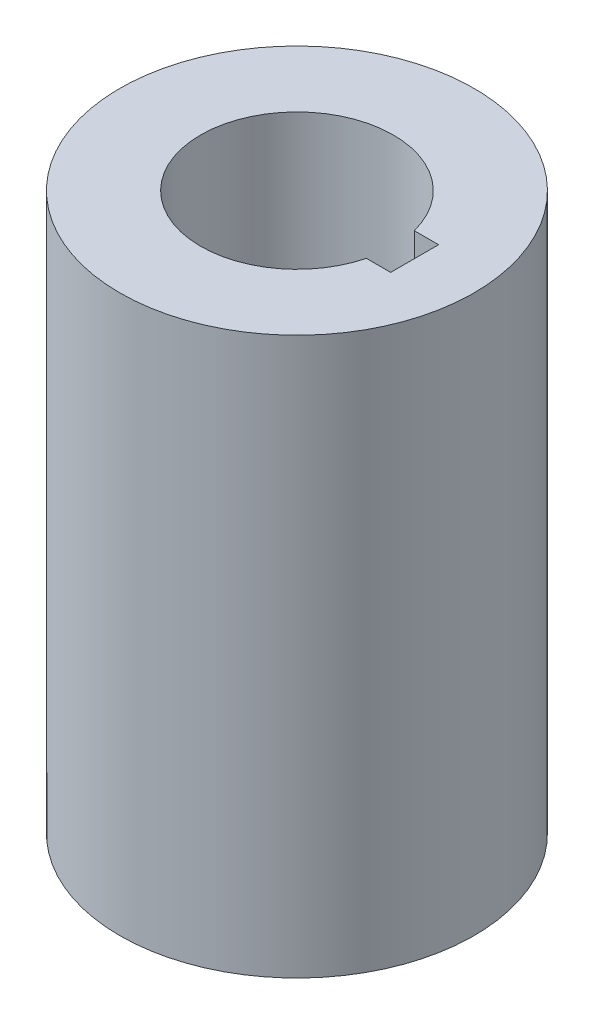
from build123d import *

# Parameters (mm, degrees)
SKETCH1_R           = 17.5
BOSS_EXTRUDE1_DEPTH = 55
SKETCH2_R           = 9.525
CUT_EXTRUDE1_DEPTH  = 23
CUT_EXTRUDE2_REACH  = 42.454
SKETCH5_R           = 6
CUT_EXTRUDE3_DEPTH  = 23


with BuildPart() as part:
    # Sketch1 → Boss-Extrude1 (new body)
    with BuildSketch(Plane(origin=(0, 0, 0), x_dir=(1, 0, 0), z_dir=(0, 1, 0))):
        with Locations(Location((0, 0, 0), (0, 0, 270))):
            Circle(SKETCH1_R)
    extrude(amount=BOSS_EXTRUDE1_DEPTH)

    # Sketch2 → Cut-Extrude1 (cut)
    with BuildSketch(Plane(origin=(0, 55, 0), x_dir=(1, 0, 0), z_dir=(0, 1, 0))):
        with Locations(Location((0, 0, 0), (0, 0, 270))):
            Circle(SKETCH2_R)
    extrude(amount=-CUT_EXTRUDE1_DEPTH, mode=Mode.SUBTRACT)

    # Sketch3 → Cut-Extrude2 (cut, up to next)
    with BuildSketch(Plane(origin=(0, 32, 0), x_dir=(1, 0, 0), z_dir=(0, 1, 0)), mode=Mode.PRIVATE) as cut_extrude2_sk1:
        Polygon((9.525, 2.37), (11.625, 2.37), (11.625, -2.366924295), (6.895, -2.366924295), (6.895, 2.37), align=None)
    cut_extrude2_tool1 = extrude(cut_extrude2_sk1.sketch, amount=CUT_EXTRUDE2_REACH, mode=Mode.PRIVATE) & part.part
    add(cut_extrude2_tool1.solids().sort_by_distance((9.26, 32, -0.001538))[0], mode=Mode.SUBTRACT)

    # Sketch5 → Cut-Extrude3 (cut)
    with BuildSketch(Plane(origin=(0, 0, 0), x_dir=(-1, 0, 0), z_dir=(0, -1, 0))):
        with Locations(Location((0, 0, 0), (0, 0, 90))):
            Circle(SKETCH5_R)
    extrude(amount=-CUT_EXTRUDE3_DEPTH, mode=Mode.SUBTRACT)


solid = part.part
